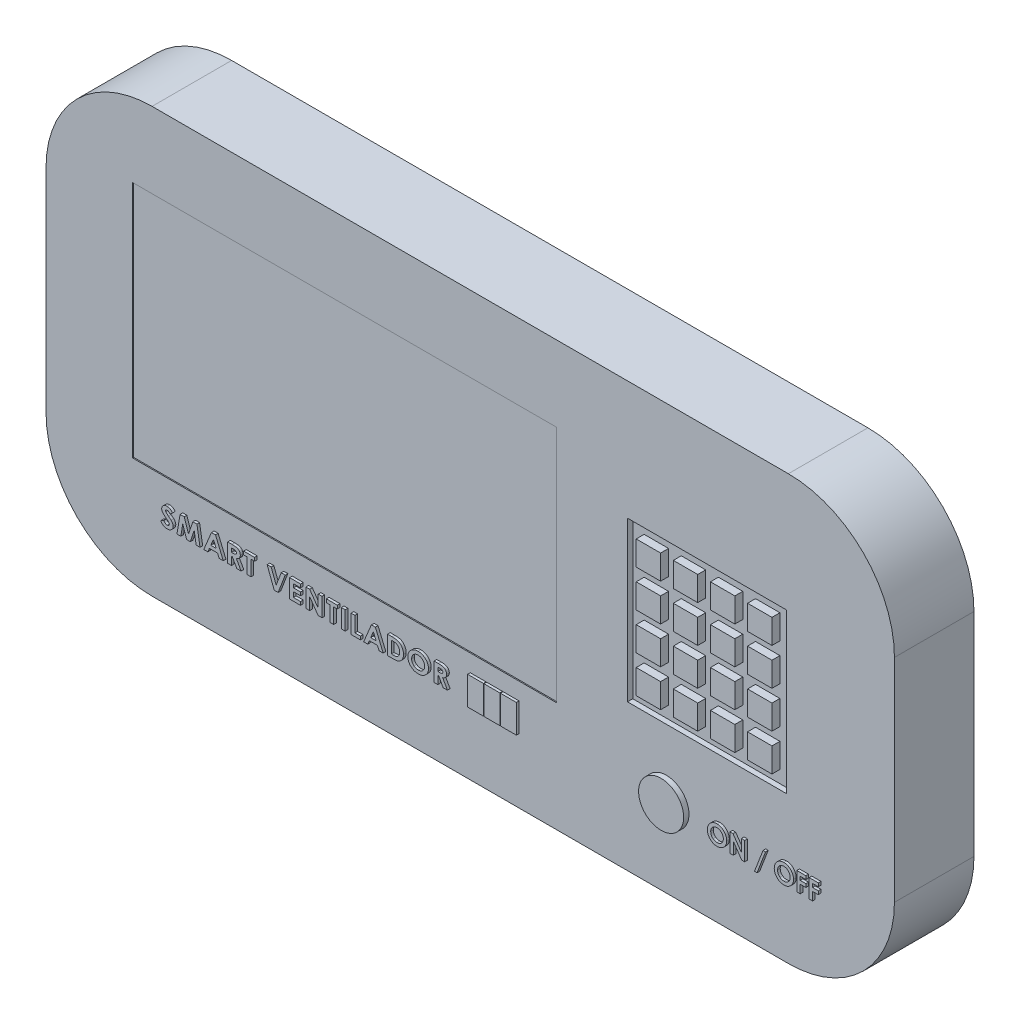
from build123d import *

# Parameters (mm, degrees)
SALIENTE_EXTRUIR1_DEPTH = 15
CROQUIS2_W              = 0.717948718
CROQUIS2_H              = 3.5
SALIENTE_EXTRUIR2_DEPTH = 0.5
SALIENTE_EXTRUIR3_DEPTH = 0.5
CROQUIS4_W              = 3
CROQUIS4_H              = 5.35
SALIENTE_EXTRUIR4_DEPTH = 0.5
CROQUIS5_W              = 80
CROQUIS5_H              = 45
CORTAR_EXTRUIR1_DEPTH   = 0.2
CROQUIS6_R              = 4.25
SALIENTE_EXTRUIR5_DEPTH = 1
CROQUIS7_W              = 30
CROQUIS7_H              = 30
CORTAR_EXTRUIR2_DEPTH   = 1
CROQUIS8_W              = 4.6
CROQUIS8_H              = 4.6
SALIENTE_EXTRUIR6_DEPTH = 1.5


with BuildPart() as part:
    # Croquis1 → Saliente-Extruir1 (new body)
    with BuildSketch(Plane.XY):
        with BuildLine():
            Line((-60, 40), (60, 40))
            ThreePointArc((60, 40), (74.142135624, 34.142135624), (80, 20))
            Line((80, 20), (80, -20))
            ThreePointArc((80, -20), (74.142135624, -34.142135624), (60, -40))
            Line((60, -40), (-60, -40))
            ThreePointArc((-60, -40), (-74.142135624, -34.142135624), (-80, -20))
            Line((-80, -20), (-80, 20))
            ThreePointArc((-80, 20), (-74.142135624, 34.142135624), (-60, 40))
        make_face()
    extrude(amount=SALIENTE_EXTRUIR1_DEPTH)

    # Croquis2 → Saliente-Extruir2 (add)
    # profile 1 of 15: a face of its own
    with BuildSketch(Plane.XY.offset(15)):
        with BuildLine():
            Line((-55.621794872, -23.967648237), (-56.124499199, -24.397435897))
            add(Edge.make_bspline(
                [(-56.124499199, -24.397435897), (-56.146289856, -24.369052903), (-56.188135035, -24.314548283), (-56.25497565, -24.241417992), (-56.321613686, -24.178938925), (-56.389157899, -24.127891339), (-56.457402581, -24.088145818), (-56.525956881, -24.059708882), (-56.594969249, -24.041735408), (-56.641356448, -24.039546945), (-56.664362981, -24.038461538)],
                knots=[0, 0, 0, 0, 1.277318712, 2.45286911, 3.533588782, 4.535065184, 5.46981375, 6.345469513, 7.179407024, 8, 8, 8, 8], degree=3))
            add(Edge.make_bspline(
                [(-56.664362981, -24.038461538), (-56.685708, -24.039134703), (-56.726753785, -24.040429176), (-56.785411939, -24.054125009), (-56.837942834, -24.076617586), (-56.883402375, -24.107395247), (-56.919967376, -24.143408068), (-56.948410812, -24.181892879), (-56.964226243, -24.224287201), (-56.966717538, -24.253360534), (-56.967948718, -24.267728365)],
                knots=[0, 0, 0, 0, 1.217479296, 2.341173553, 3.417477448, 4.465338837, 5.456563799, 6.338062097, 7.178682312, 8, 8, 8, 8], degree=3))
            add(Edge.make_bspline(
                [(-56.967948718, -24.267728365), (-56.967009562, -24.282279816), (-56.965119584, -24.311563489), (-56.953687441, -24.354965153), (-56.933634537, -24.39668002), (-56.915522489, -24.422220823), (-56.90625, -24.435296474)],
                knots=[0, 0, 0, 0, 0.961387754, 1.934718672, 2.942676219, 4, 4, 4, 4], degree=3))
            add(Edge.make_bspline(
                [(-56.90625, -24.435296474), (-56.897475032, -24.445443587), (-56.8773462, -24.468719972), (-56.839966216, -24.505985803), (-56.792711248, -24.551312586), (-56.73411001, -24.603713536), (-56.665633125, -24.664052852), (-56.585804218, -24.73140971), (-56.495945341, -24.806807025), (-56.432106155, -24.859299305), (-56.398637821, -24.88681891)],
                knots=[0, 0, 0, 0, 0.473340372, 1.085791838, 1.861725834, 2.784458208, 3.859937724, 5.082978446, 6.470722139, 8, 8, 8, 8], degree=3))
            add(Edge.make_bspline(
                [(-56.398637821, -24.88681891), (-56.367365202, -24.912346913), (-56.307902408, -24.960886702), (-56.222817611, -25.02895694), (-56.14876769, -25.091314709), (-56.083233629, -25.144587126), (-56.028757454, -25.192132522), (-55.982907862, -25.231042236), (-55.94721146, -25.263154834), (-55.926982844, -25.282449354), (-55.918369391, -25.290665064)],
                knots=[0, 0, 0, 0, 1.543675599, 2.93519593, 4.166390145, 5.245405028, 6.164324761, 6.931062555, 7.544840672, 8, 8, 8, 8], degree=3))
            add(Edge.make_bspline(
                [(-55.918369391, -25.290665064), (-55.885307432, -25.324027525), (-55.82196052, -25.387950201), (-55.7400681, -25.488103721), (-55.671208768, -25.584606887), (-55.619286054, -25.681766822), (-55.580173713, -25.779444659), (-55.551371343, -25.880075893), (-55.535469285, -25.985433689), (-55.533199129, -26.057175217), (-55.532051282, -26.093449519)],
                knots=[0, 0, 0, 0, 1.227179859, 2.351284024, 3.378339862, 4.321367522, 5.223305034, 6.124621562, 7.051761985, 8, 8, 8, 8], degree=3))
            add(Edge.make_bspline(
                [(-55.532051282, -26.093449519), (-55.532948725, -26.128793717), (-55.534710133, -26.198163628), (-55.549946823, -26.299891443), (-55.57419614, -26.396801614), (-55.608795548, -26.489155011), (-55.65435804, -26.576108706), (-55.707965454, -26.65967524), (-55.773666543, -26.736640245), (-55.846628631, -26.809722689), (-55.928573554, -26.874969173), (-56.016483024, -26.933116888), (-56.110877326, -26.981444891), (-56.211416346, -27.021013696), (-56.317860466, -27.051443209), (-56.430102551, -27.074099574), (-56.548345125, -27.087607188), (-56.629271305, -27.089020527), (-56.670673077, -27.08974359)],
                knots=[0, 0, 0, 0, 0.999766624, 1.962237841, 2.90384921, 3.82270094, 4.745614044, 5.677512525, 6.625951363, 7.603395152, 8.596026376, 9.584772012, 10.581624785, 11.591187941, 12.637768575, 13.710459695, 14.828672936, 16, 16, 16, 16], degree=3))
            add(Edge.make_bspline(
                [(-56.670673077, -27.08974359), (-56.703176817, -27.089217749), (-56.767360292, -27.088179398), (-56.861969011, -27.079567785), (-56.953329077, -27.065688977), (-57.041404863, -27.045967813), (-57.126450099, -27.02069371), (-57.208533337, -26.989940404), (-57.287284149, -26.953377679), (-57.362850669, -26.911094006), (-57.435238015, -26.8624943), (-57.504855089, -26.807646704), (-57.571531972, -26.746159084), (-57.636403669, -26.678885064), (-57.697615102, -26.604360338), (-57.757027279, -26.524139134), (-57.812975486, -26.436968651), (-57.847680101, -26.375704797), (-57.865384615, -26.344451122)],
                knots=[0, 0, 0, 0, 1.047498313, 2.068441419, 3.059231922, 4.024170881, 4.975130488, 5.916735576, 6.846911781, 7.770998236, 8.70488822, 9.654295141, 10.62465836, 11.626271271, 12.664055072, 13.730743618, 14.842341825, 16, 16, 16, 16], degree=3))
            Line((-57.865384615, -26.344451122), (-57.280649038, -26.012820513))
            add(Edge.make_bspline(
                [(-57.280649038, -26.012820513), (-57.258849225, -26.048304191), (-57.216972833, -26.116466628), (-57.146506653, -26.207835884), (-57.074332303, -26.285754338), (-56.999642452, -26.349882612), (-56.92189244, -26.399871584), (-56.841235638, -26.435248222), (-56.758099105, -26.457514661), (-56.701655962, -26.460198563), (-56.673477564, -26.461538462)],
                knots=[0, 0, 0, 0, 1.263139482, 2.426430153, 3.495266246, 4.48153534, 5.406311373, 6.289232501, 7.145924809, 8, 8, 8, 8], degree=3))
            add(Edge.make_bspline(
                [(-56.673477564, -26.461538462), (-56.644611798, -26.460427934), (-56.588553277, -26.458271242), (-56.50847831, -26.438670575), (-56.435087107, -26.407823413), (-56.371715304, -26.363592617), (-56.318347924, -26.312523326), (-56.278505191, -26.255952761), (-56.254501415, -26.194111778), (-56.25150506, -26.151374612), (-56.25, -26.129907853)],
                knots=[0, 0, 0, 0, 1.163832301, 2.260210803, 3.308505476, 4.360742954, 5.361758128, 6.277907902, 7.134997948, 8, 8, 8, 8], degree=3))
            add(Edge.make_bspline(
                [(-56.25, -26.129907853), (-56.251053154, -26.109913324), (-56.25319924, -26.069169086), (-56.272198552, -26.008810139), (-56.301357619, -25.948683936), (-56.334962444, -25.899221318), (-56.36915887, -25.857510997), (-56.403101085, -25.82237622), (-56.44285038, -25.782162626), (-56.490221528, -25.738823552), (-56.544215052, -25.691417385), (-56.60440172, -25.639060929), (-56.672627629, -25.58424669), (-56.720215817, -25.546101686), (-56.744991987, -25.526241987)],
                knots=[0, 0, 0, 0, 0.892402583, 1.818510659, 2.804945013, 3.874697065, 4.483648646, 5.215708092, 6.058298861, 7.012472764, 8.086251532, 9.272156419, 10.579783825, 12, 12, 12, 12], degree=3))
            add(Edge.make_bspline(
                [(-56.744991987, -25.526241987), (-56.792595144, -25.488580671), (-56.883801312, -25.416422761), (-57.012482935, -25.309445746), (-57.1282728, -25.209257028), (-57.231319178, -25.115932348), (-57.320538304, -25.028596536), (-57.397498672, -24.949037383), (-57.460855337, -24.875621628), (-57.526514531, -24.788161755), (-57.589860792, -24.682245905), (-57.644464019, -24.554229067), (-57.679918898, -24.426214145), (-57.683927776, -24.340158058), (-57.685897436, -24.297876603)],
                knots=[0, 0, 0, 0, 1.365689936, 2.616619431, 3.764752617, 4.810693309, 5.744036183, 6.573410299, 7.300607496, 7.924251543, 9.032571599, 10.066881874, 11.050211877, 12, 12, 12, 12], degree=3))
            add(Edge.make_bspline(
                [(-57.685897436, -24.297876603), (-57.685252341, -24.267897142), (-57.683979896, -24.208762954), (-57.668940926, -24.12192614), (-57.646929887, -24.038089329), (-57.615077998, -23.957638929), (-57.573918159, -23.880672583), (-57.52397253, -23.806805574), (-57.464605843, -23.73648345), (-57.396962419, -23.670306604), (-57.322540274, -23.610146588), (-57.243769314, -23.555987631), (-57.159796657, -23.511319482), (-57.072140727, -23.473970396), (-56.980127657, -23.444934379), (-56.883837145, -23.424808468), (-56.783159403, -23.412750318), (-56.714643344, -23.411097325), (-56.67978766, -23.41025641)],
                knots=[0, 0, 0, 0, 0.963119029, 1.899742706, 2.825934193, 3.747110609, 4.675130108, 5.627810591, 6.609404785, 7.629881686, 8.666397204, 9.683713782, 10.699279647, 11.719756548, 12.744294213, 13.79681864, 14.879191321, 16, 16, 16, 16], degree=3))
            add(Edge.make_bspline(
                [(-56.67978766, -23.41025641), (-56.634587808, -23.411762324), (-56.544798192, -23.414753825), (-56.412132871, -23.438090378), (-56.282727228, -23.4753693), (-56.177833707, -23.519282189), (-56.094673672, -23.563292532), (-56.030307968, -23.602325975), (-55.965302292, -23.648471373), (-55.898169078, -23.699329681), (-55.831367999, -23.758336927), (-55.761687897, -23.821642087), (-55.691581219, -23.892124724), (-55.645472562, -23.942023994), (-55.621794872, -23.967648237)],
                knots=[0, 0, 0, 0, 1.316312799, 2.614858576, 3.91215405, 5.233669687, 5.919003686, 6.652379443, 7.424978738, 8.240779349, 9.104907034, 10.020538666, 10.983508212, 12, 12, 12, 12], degree=3))
        make_face()
    # profile 2 of 15: a face of its own
    with BuildSketch(Plane.XY.offset(15)):
        Polygon((-54.222075321, -23.5), (-53.447335737, -23.5), (-52.633333333, -25.94130609), (-51.815825321, -23.5), (-51.044591346, -23.5), (-50.457051282, -27), (-51.185516827, -27), (-51.556410256, -24.789362981), (-52.296794872, -27), (-52.973377404, -27), (-53.71025641, -24.789362981), (-54.08114984, -27), (-54.809615385, -27), align=None)
    # profile 3 of 15: a face of its own
    with BuildSketch(Plane.XY.offset(15)):
        Polygon((-48.295913462, -23.5), (-47.538000801, -23.5), (-46.077564103, -27), (-46.848096955, -27), (-47.144671474, -26.282051282), (-48.689242788, -26.282051282), (-48.986518429, -27), (-49.757051282, -27), align=None)
        Polygon((-47.917307692, -24.438802083), (-48.428425481, -25.653846154), (-47.405488782, -25.653846154), align=None, mode=Mode.SUBTRACT)
    # profile 4 of 15: a face of its own
    with BuildSketch(Plane.XY.offset(15)):
        with BuildLine():
            Line((-45.242948718, -23.5), (-44.434555288, -23.5))
            add(Edge.make_bspline(
                [(-44.434555288, -23.5), (-44.381265107, -23.500175455), (-44.278632901, -23.500513366), (-44.130665267, -23.50568712), (-43.99433399, -23.513039221), (-43.870110327, -23.52389994), (-43.757874139, -23.538732198), (-43.657705195, -23.55600658), (-43.568980481, -23.575772154), (-43.491022503, -23.600042918), (-43.420856154, -23.628026155), (-43.355416826, -23.659550691), (-43.29346326, -23.69563823), (-43.234550609, -23.735258013), (-43.179597542, -23.77978462), (-43.128302073, -23.828546519), (-43.079767227, -23.880839033), (-43.035705744, -23.937791703), (-42.99602803, -23.997861877), (-42.960271026, -24.060511138), (-42.931347988, -24.126567713), (-42.906347379, -24.194786083), (-42.887490806, -24.265906832), (-42.874251013, -24.339534118), (-42.866447877, -24.415964307), (-42.865319344, -24.46776372), (-42.86474359, -24.494190705)],
                knots=[0, 0, 0, 0, 1.810401764, 3.486674673, 5.029519145, 6.448546818, 7.721978868, 8.874627388, 9.901230509, 10.807823259, 11.645301282, 12.465628286, 13.273214053, 14.079237002, 14.87534365, 15.672913984, 16.482098508, 17.29687332, 18.116085201, 18.926632022, 19.744110526, 20.562899031, 21.393004911, 22.24024988, 23.102212043, 24, 24, 24, 24], degree=3))
            add(Edge.make_bspline(
                [(-42.86474359, -24.494190705), (-42.865277465, -24.521787566), (-42.866325172, -24.57594527), (-42.874702614, -24.655488775), (-42.889511733, -24.731427067), (-42.909971812, -24.80409851), (-42.935655738, -24.873449017), (-42.967609643, -24.939395684), (-43.005274263, -25.001710069), (-43.049425298, -25.060217987), (-43.098206122, -25.115795368), (-43.153745284, -25.167215024), (-43.21442884, -25.215665542), (-43.281762551, -25.259625991), (-43.354067033, -25.301386036), (-43.432750456, -25.338886201), (-43.516967545, -25.37349185), (-43.575784557, -25.392920204), (-43.605829327, -25.402844551)],
                knots=[0, 0, 0, 0, 1.043198031, 2.047233251, 3.01934853, 3.964797548, 4.898614941, 5.811463997, 6.731256592, 7.646625036, 8.579229433, 9.523149634, 10.504257845, 11.511437172, 12.560232801, 13.658834121, 14.804091076, 16, 16, 16, 16], degree=3))
            Line((-43.605829327, -25.402844551), (-42.707692308, -27))
            Line((-42.707692308, -27), (-43.516786859, -27))
            Line((-43.516786859, -27), (-44.374959936, -25.474358974))
            Line((-44.374959936, -25.474358974), (-44.525, -25.474358974))
            Line((-44.525, -25.474358974), (-44.525, -27))
            Line((-44.525, -27), (-45.242948718, -27))
            Line((-45.242948718, -27), (-45.242948718, -23.5))
        make_face()
        with BuildLine():
            Line((-44.525, -24.846153846), (-44.268389423, -24.846153846))
            add(Edge.make_bspline(
                [(-44.268389423, -24.846153846), (-44.237071472, -24.845817383), (-44.176985908, -24.845171855), (-44.090408914, -24.842157457), (-44.011610482, -24.835005721), (-43.940308176, -24.825797843), (-43.876558454, -24.815495782), (-43.820773726, -24.800237994), (-43.772105192, -24.784052005), (-43.730652697, -24.764222204), (-43.69541783, -24.741216654), (-43.664877222, -24.715344442), (-43.639505477, -24.685290038), (-43.617896401, -24.652405244), (-43.60296089, -24.614982636), (-43.590747108, -24.575232984), (-43.583613224, -24.531601574), (-43.583007509, -24.501461499), (-43.582692308, -24.485777244)],
                knots=[0, 0, 0, 0, 1.708363675, 3.277608857, 4.723712974, 6.021838054, 7.199660436, 8.241690857, 9.172961181, 9.993967569, 10.739999558, 11.46313589, 12.168296226, 12.87908003, 13.598837728, 14.357076655, 15.145057537, 16, 16, 16, 16], degree=3))
            add(Edge.make_bspline(
                [(-43.582692308, -24.485777244), (-43.583336018, -24.467209088), (-43.584602537, -24.43067567), (-43.599535983, -24.378341143), (-43.62204024, -24.329279661), (-43.654852889, -24.285602051), (-43.694278284, -24.245850119), (-43.740851398, -24.212329472), (-43.793446601, -24.184692941), (-43.842302226, -24.167102448), (-43.886985236, -24.156141878), (-43.927224607, -24.148536479), (-43.974072094, -24.142480076), (-44.026881891, -24.136801518), (-44.086283572, -24.132702433), (-44.151978891, -24.129955443), (-44.224214644, -24.128766607), (-44.274465631, -24.12839743), (-44.300641026, -24.128205128)],
                knots=[0, 0, 0, 0, 0.985252127, 1.938513972, 2.873098658, 3.843165384, 4.828025027, 5.842890392, 6.883115312, 7.980634618, 8.595920604, 9.330050158, 10.158404267, 11.108741491, 12.156004298, 13.326020887, 14.60714262, 16, 16, 16, 16], degree=3))
            Line((-44.300641026, -24.128205128), (-44.525, -24.128205128))
            Line((-44.525, -24.128205128), (-44.525, -24.846153846))
        make_face(mode=Mode.SUBTRACT)
    # profile 5 of 15: a face of its own
    with BuildSketch(Plane.XY.offset(15)):
        Polygon((-42.232051282, -23.5), (-40.167948718, -23.5), (-40.167948718, -24.128205128), (-40.841025641, -24.128205128), (-40.841025641, -27), (-41.558974359, -27), (-41.558974359, -24.128205128), (-42.232051282, -24.128205128), align=None)
    # profile 6 of 15: a face of its own
    with BuildSketch(Plane.XY.offset(15)):
        Polygon((-37.803205128, -23.5), (-37.045292468, -23.5), (-36.098076923, -25.986177885), (-35.150160256, -23.5), (-34.392948718, -23.5), (-35.728585737, -27), (-36.469671474, -27), align=None)
    # profile 7 of 15: a face of its own
    with BuildSketch(Plane.XY.offset(15)):
        Polygon((-33.558333333, -23.5), (-31.494230769, -23.5), (-31.494230769, -24.128205128), (-32.840384615, -24.128205128), (-32.840384615, -24.801282051), (-31.494230769, -24.801282051), (-31.494230769, -25.429487179), (-32.840384615, -25.429487179), (-32.840384615, -26.371794872), (-31.494230769, -26.371794872), (-31.494230769, -27), (-33.558333333, -27), align=None)
    # profile 8 of 15: a face of its own
    with BuildSketch(Plane.XY.offset(15)):
        Polygon((-30.502564103, -23.5), (-29.784615385, -23.5), (-28.169230769, -25.803185096), (-28.169230769, -23.5), (-27.451282051, -23.5), (-27.451282051, -27), (-28.174138622, -27), (-29.784615385, -24.703826122), (-29.784615385, -27), (-30.502564103, -27), align=None)
    # profile 9 of 15: a face of its own
    with BuildSketch(Plane.XY.offset(15)):
        Polygon((-26.639102564, -23.5), (-24.575, -23.5), (-24.575, -24.128205128), (-25.248076923, -24.128205128), (-25.248076923, -27), (-25.966025641, -27), (-25.966025641, -24.128205128), (-26.639102564, -24.128205128), align=None)
    # profile 10 of 15: a face of its own
    with BuildSketch(Plane.XY.offset(15)):
        with Locations((-23.448717949, -25.25)):
            Rectangle(CROQUIS2_W, CROQUIS2_H)
    # profile 11 of 15: a face of its own
    with BuildSketch(Plane.XY.offset(15)):
        Polygon((-21.963461538, -23.5), (-21.245512821, -23.5), (-21.245512821, -26.371794872), (-20.213461538, -26.371794872), (-20.213461538, -27), (-21.963461538, -27), align=None)
    # profile 12 of 15: a face of its own
    with BuildSketch(Plane.XY.offset(15)):
        Polygon((-18.142067308, -23.5), (-17.384154647, -23.5), (-15.923717949, -27), (-16.694250801, -27), (-16.990825321, -26.282051282), (-18.535396635, -26.282051282), (-18.832672276, -27), (-19.603205128, -27), align=None)
        Polygon((-17.763461538, -24.438802083), (-18.274579327, -25.653846154), (-17.251642628, -25.653846154), align=None, mode=Mode.SUBTRACT)
    # profile 13 of 15: a face of its own
    with BuildSketch(Plane.XY.offset(15)):
        with BuildLine():
            Line((-15.089102564, -23.5), (-14.233733974, -23.5))
            add(Edge.make_bspline(
                [(-14.233733974, -23.5), (-14.167115878, -23.500440041), (-14.038019366, -23.50129278), (-13.851172702, -23.510604157), (-13.677398484, -23.525141864), (-13.517020687, -23.544900338), (-13.369748206, -23.571440439), (-13.235954914, -23.603997662), (-13.11523895, -23.642541745), (-13.006167626, -23.686839375), (-12.906658687, -23.739404228), (-12.812176127, -23.797553853), (-12.722509227, -23.863602285), (-12.637169505, -23.93693004), (-12.556419678, -24.01787888), (-12.480017709, -24.1061978), (-12.408543125, -24.202072298), (-12.341190839, -24.304013839), (-12.280380071, -24.412095913), (-12.227696191, -24.525643104), (-12.182676845, -24.643413628), (-12.1463217, -24.766076498), (-12.117455275, -24.892974439), (-12.097277451, -25.024410198), (-12.085193718, -25.160262092), (-12.083535015, -25.252312227), (-12.082692308, -25.299078526)],
                knots=[0, 0, 0, 0, 1.494078584, 2.895314429, 4.194726073, 5.404700159, 6.518210919, 7.549273854, 8.490856347, 9.358190944, 10.185824783, 11.01206306, 11.844513431, 12.680866051, 13.533374415, 14.406691734, 15.29780874, 16.213741172, 17.145466963, 18.07648471, 19.018854785, 19.970798204, 20.943612606, 21.93555847, 22.95115539, 24, 24, 24, 24], degree=3))
            add(Edge.make_bspline(
                [(-12.082692308, -25.299078526), (-12.084385202, -25.365081884), (-12.087719972, -25.495099473), (-12.115837034, -25.685863659), (-12.161238187, -25.868758476), (-12.225295063, -26.04208324), (-12.303767102, -26.204966693), (-12.398321804, -26.353557636), (-12.506210158, -26.488135732), (-12.627351514, -26.60667599), (-12.757680651, -26.709560333), (-12.894126352, -26.796648146), (-13.036654089, -26.865975127), (-13.162033234, -26.909363105), (-13.270866491, -26.936930779), (-13.366414268, -26.95272168), (-13.475314811, -26.967747647), (-13.598166392, -26.979006885), (-13.734637039, -26.989235262), (-13.884776542, -26.994759812), (-14.048375565, -26.999369193), (-14.161981668, -26.999784061), (-14.221113782, -27)],
                knots=[0, 0, 0, 0, 1.259954248, 2.481937546, 3.673749466, 4.852781836, 6.004533842, 7.120124249, 8.208893917, 9.291425112, 10.349538388, 11.374759778, 12.37682138, 13.36910449, 13.902767555, 14.519139419, 15.217253139, 16.001986812, 16.874547636, 17.830513077, 18.870779437, 20, 20, 20, 20], degree=3))
            Line((-14.221113782, -27), (-15.089102564, -27))
            Line((-15.089102564, -27), (-15.089102564, -23.5))
        make_face()
        with BuildLine():
            Line((-14.371153846, -24.128205128), (-14.371153846, -26.371794872))
            Line((-14.371153846, -26.371794872), (-14.033914263, -26.371794872))
            add(Edge.make_bspline(
                [(-14.033914263, -26.371794872), (-13.993704364, -26.371720764), (-13.916279183, -26.371578068), (-13.804591698, -26.365050097), (-13.701305501, -26.358446668), (-13.606687144, -26.345933026), (-13.520049075, -26.332138277), (-13.442607731, -26.312648738), (-13.37293984, -26.292489306), (-13.311761484, -26.26650573), (-13.255726005, -26.237163866), (-13.20327454, -26.203482696), (-13.153099363, -26.165283512), (-13.105516099, -26.122811234), (-13.06131997, -26.075170377), (-13.018862434, -26.024048773), (-12.979718256, -25.967483223), (-12.942824585, -25.906935021), (-12.908685442, -25.842434031), (-12.880470513, -25.773629266), (-12.855601119, -25.701601924), (-12.835272514, -25.62596695), (-12.820073887, -25.546478663), (-12.808922419, -25.463389795), (-12.801628614, -25.3767997), (-12.800973365, -25.317790001), (-12.800641026, -25.287860577)],
                knots=[0, 0, 0, 0, 1.523669709, 2.933864728, 4.239623319, 5.444890021, 6.550182806, 7.56208441, 8.469926649, 9.295760893, 10.07631634, 10.865071544, 11.655218202, 12.464400176, 13.279042311, 14.116059622, 14.981059707, 15.883440539, 16.80262051, 17.743607914, 18.698829689, 19.68937621, 20.709117789, 21.763920273, 22.865871542, 24, 24, 24, 24], degree=3))
            add(Edge.make_bspline(
                [(-12.800641026, -25.287860577), (-12.801795131, -25.242014036), (-12.804045335, -25.152625322), (-12.819303878, -25.022278692), (-12.845968965, -24.89972513), (-12.883039503, -24.785002249), (-12.93055445, -24.678033878), (-12.990623732, -24.580323287), (-13.058658021, -24.48838639), (-13.113267077, -24.435304905), (-13.140685096, -24.408653846)],
                knots=[0, 0, 0, 0, 1.132793406, 2.208649617, 3.237138899, 4.226931707, 5.183258886, 6.121135875, 7.056663184, 8, 8, 8, 8], degree=3))
            add(Edge.make_bspline(
                [(-13.140685096, -24.408653846), (-13.167686105, -24.38589392), (-13.222710946, -24.339511899), (-13.318325142, -24.283376889), (-13.424073668, -24.2344774), (-13.542096734, -24.195782766), (-13.671289041, -24.164948743), (-13.812267233, -24.143866178), (-13.964465887, -24.130197716), (-14.069873194, -24.12888413), (-14.124358974, -24.128205128)],
                knots=[0, 0, 0, 0, 0.809370818, 1.64940136, 2.535194483, 3.480162931, 4.495135713, 5.58092784, 6.749564542, 8, 8, 8, 8], degree=3))
            Line((-14.124358974, -24.128205128), (-14.371153846, -24.128205128))
        make_face(mode=Mode.SUBTRACT)
    # profile 14 of 15: a face of its own
    with BuildSketch(Plane.XY.offset(15)):
        with BuildLine():
            add(Edge.make_bspline(
                [(-9.310877404, -23.41025641), (-9.245590426, -23.41183385), (-9.116622242, -23.41494993), (-8.926933465, -23.44085525), (-8.744223954, -23.482788879), (-8.568635489, -23.542172451), (-8.399822241, -23.617866054), (-8.23837791, -23.711439702), (-8.083650393, -23.820935467), (-7.938540025, -23.946717266), (-7.804564749, -24.083115991), (-7.687498586, -24.229459884), (-7.588968719, -24.383431862), (-7.506422489, -24.543723881), (-7.444132904, -24.712725905), (-7.399136318, -24.888644483), (-7.371873427, -25.072233743), (-7.368420677, -25.197089574), (-7.366666667, -25.260516827)],
                knots=[0, 0, 0, 0, 1.049696402, 2.073574885, 3.072906237, 4.060690321, 5.04995375, 6.043499802, 7.057254493, 8.094057568, 9.12807687, 10.128390374, 11.102251621, 12.063819208, 13.022458253, 13.992481724, 14.980172828, 16, 16, 16, 16], degree=3))
            add(Edge.make_bspline(
                [(-7.366666667, -25.260516827), (-7.368492357, -25.323236969), (-7.372091511, -25.446883058), (-7.398374579, -25.628619092), (-7.442560798, -25.803101475), (-7.505515169, -25.969743308), (-7.585112963, -26.129591794), (-7.683210773, -26.281474162), (-7.7991837, -26.425780526), (-7.930557875, -26.561311217), (-8.074866142, -26.684520942), (-8.228026734, -26.793316836), (-8.389433547, -26.884555986), (-8.55793463, -26.960471327), (-8.734499069, -27.01852903), (-8.918329075, -27.059837069), (-9.109660605, -27.084961584), (-9.239753736, -27.088130599), (-9.305969551, -27.08974359)],
                knots=[0, 0, 0, 0, 1.014050959, 1.999093624, 2.962474041, 3.919248956, 4.874193364, 5.844951248, 6.837131159, 7.863453727, 8.892777976, 9.901511838, 10.896710297, 11.886360502, 12.885490882, 13.896784394, 14.929488937, 16, 16, 16, 16], degree=3))
            add(Edge.make_bspline(
                [(-9.305969551, -27.08974359), (-9.375008423, -27.088291799), (-9.510554411, -27.085441458), (-9.709149767, -27.05812464), (-9.899532131, -27.017235428), (-10.080215407, -26.955959934), (-10.252629891, -26.879751533), (-10.415281427, -26.784791757), (-10.569479181, -26.673684892), (-10.712752381, -26.546646581), (-10.842831468, -26.408271166), (-10.957455281, -26.26191399), (-11.05378386, -26.108597758), (-11.132987114, -25.948899842), (-11.195210409, -25.78316189), (-11.238294393, -25.610473675), (-11.266229058, -25.431802797), (-11.269073149, -25.310168669), (-11.270512821, -25.248597756)],
                knots=[0, 0, 0, 0, 1.104586766, 2.168666752, 3.203450315, 4.217361517, 5.217176418, 6.21629109, 7.226606606, 8.255013025, 9.276660051, 10.26302175, 11.226301965, 12.16996216, 13.11228646, 14.054165042, 15.015022858, 16, 16, 16, 16], degree=3))
            add(Edge.make_bspline(
                [(-11.270512821, -25.248597756), (-11.269651696, -25.207204372), (-11.267940501, -25.124948905), (-11.255839161, -25.002866017), (-11.235650118, -24.883327473), (-11.206465321, -24.766577319), (-11.170354647, -24.652025237), (-11.124891718, -24.540329029), (-11.072595941, -24.430618131), (-11.011247185, -24.324426444), (-10.943983444, -24.221627635), (-10.868976747, -24.124556215), (-10.788455673, -24.032496831), (-10.701342532, -23.946250725), (-10.608319395, -23.865612829), (-10.510278383, -23.789119478), (-10.404536733, -23.720289994), (-10.294243443, -23.655890436), (-10.179860861, -23.597476314), (-10.061799015, -23.548383894), (-9.942386308, -23.504631261), (-9.820018286, -23.470987487), (-9.695922658, -23.442910277), (-9.569295599, -23.424727916), (-9.440852154, -23.41183422), (-9.354379952, -23.410784503), (-9.310877404, -23.41025641)],
                knots=[0, 0, 0, 0, 0.997678596, 1.982551546, 2.954058229, 3.917298017, 4.881130648, 5.846673895, 6.821767171, 7.808378587, 8.800523032, 9.780793558, 10.762778381, 11.746684189, 12.732909544, 13.728980508, 14.741436122, 15.771402875, 16.806854874, 17.834307421, 18.851765781, 19.870097094, 20.891120496, 21.916470583, 22.951815307, 24, 24, 24, 24], degree=3))
        make_face()
        with BuildLine():
            add(Edge.make_bspline(
                [(-9.321394231, -24.038461538), (-9.363982299, -24.0395518), (-9.447832752, -24.041698384), (-9.570804888, -24.05826183), (-9.688813221, -24.084622187), (-9.801426864, -24.122875871), (-9.909094202, -24.171249157), (-10.011566728, -24.230626805), (-10.108464839, -24.30101369), (-10.199109063, -24.381505835), (-10.282207388, -24.469442718), (-10.354274515, -24.565102058), (-10.415430558, -24.666103175), (-10.465536208, -24.773069339), (-10.505375122, -24.885641786), (-10.531864996, -25.004577872), (-10.549615725, -25.128874415), (-10.55156778, -25.213710923), (-10.552564103, -25.257011218)],
                knots=[0, 0, 0, 0, 1.055204393, 2.077562293, 3.069591117, 4.047707093, 5.019870956, 5.990497881, 6.977627683, 7.982959847, 8.991041444, 9.971093488, 10.945584032, 11.912071583, 12.893953377, 13.898567786, 14.927435399, 16, 16, 16, 16], degree=3))
            add(Edge.make_bspline(
                [(-10.552564103, -25.257011218), (-10.551271287, -25.305001276), (-10.54873573, -25.399122627), (-10.527275676, -25.536241973), (-10.492394087, -25.665769954), (-10.442569743, -25.787154188), (-10.380464559, -25.901861636), (-10.302036962, -26.007159969), (-10.211414419, -26.106254736), (-10.141094794, -26.163252366), (-10.105248397, -26.192307692)],
                knots=[0, 0, 0, 0, 1.069242721, 2.097071222, 3.085376775, 4.052797002, 5.015732193, 5.984778196, 6.972712951, 8, 8, 8, 8], degree=3))
            add(Edge.make_bspline(
                [(-10.105248397, -26.192307692), (-10.076162771, -26.213875259), (-10.018438342, -26.256679062), (-9.926126916, -26.311019686), (-9.831099917, -26.357809655), (-9.732721781, -26.395589889), (-9.631205614, -26.425300124), (-9.526344166, -26.446189761), (-9.418242888, -26.459175474), (-9.345035114, -26.460745676), (-9.308072917, -26.461538462)],
                knots=[0, 0, 0, 0, 1.013047639, 2.010532423, 2.993667268, 3.975386105, 4.956756072, 5.951146405, 6.965545226, 8, 8, 8, 8], degree=3))
            add(Edge.make_bspline(
                [(-9.308072917, -26.461538462), (-9.266421699, -26.460436256), (-9.184437628, -26.458266731), (-9.063705389, -26.441815916), (-8.94795747, -26.414553165), (-8.836767764, -26.376457491), (-8.730394784, -26.327018136), (-8.628632482, -26.266721732), (-8.532065884, -26.195051157), (-8.440856921, -26.114322515), (-8.357015658, -26.02568753), (-8.284935011, -25.929604525), (-8.22231683, -25.829629756), (-8.171603475, -25.724101644), (-8.133040522, -25.612936768), (-8.105074892, -25.497208805), (-8.087665977, -25.376260807), (-8.085644701, -25.293995963), (-8.084615385, -25.252103365)],
                knots=[0, 0, 0, 0, 1.042754808, 2.05250381, 3.044734659, 4.016369353, 4.99039802, 5.977003884, 6.973093156, 7.997105831, 9.023907439, 10.022314898, 10.999976081, 11.973705823, 12.947259684, 13.940853027, 14.951398795, 16, 16, 16, 16], degree=3))
            add(Edge.make_bspline(
                [(-8.084615385, -25.252103365), (-8.085656387, -25.210445433), (-8.087706236, -25.128416316), (-8.105019093, -25.007920385), (-8.133026213, -24.892349767), (-8.172261461, -24.781423231), (-8.224112525, -24.676108523), (-8.285881555, -24.574874586), (-8.360198267, -24.479647326), (-8.443806286, -24.389645375), (-8.535429044, -24.30750621), (-8.63350235, -24.235679973), (-8.735791424, -24.174227385), (-8.843610065, -24.124808149), (-8.956160167, -24.086300336), (-9.073435636, -24.057984123), (-9.195904745, -24.041756791), (-9.279045927, -24.039573571), (-9.321394231, -24.038461538)],
                knots=[0, 0, 0, 0, 1.03575694, 2.039520994, 3.020797989, 3.989755797, 4.959480517, 5.935526576, 6.934295908, 7.95845522, 8.987666614, 9.98988092, 10.977832937, 11.950601889, 12.934097473, 13.932325338, 14.946821381, 16, 16, 16, 16], degree=3))
        make_face(mode=Mode.SUBTRACT)
    # profile 15 of 15: a face of its own
    with BuildSketch(Plane.XY.offset(15)):
        with BuildLine():
            Line((-6.330128205, -23.5), (-5.521734776, -23.5))
            add(Edge.make_bspline(
                [(-5.521734776, -23.5), (-5.468444594, -23.500175455), (-5.365812388, -23.500513366), (-5.217844754, -23.50568712), (-5.081513477, -23.513039221), (-4.957289814, -23.52389994), (-4.845053626, -23.538732198), (-4.744884682, -23.55600658), (-4.656159968, -23.575772154), (-4.578201991, -23.600042918), (-4.508035641, -23.628026155), (-4.442596314, -23.659550691), (-4.380642747, -23.69563823), (-4.321730096, -23.735258013), (-4.26677703, -23.77978462), (-4.21548156, -23.828546519), (-4.166946715, -23.880839033), (-4.122885231, -23.937791703), (-4.083207517, -23.997861877), (-4.047450513, -24.060511138), (-4.018527476, -24.126567713), (-3.993526867, -24.194786083), (-3.974670293, -24.265906832), (-3.9614305, -24.339534118), (-3.953627365, -24.415964307), (-3.952498831, -24.46776372), (-3.951923077, -24.494190705)],
                knots=[0, 0, 0, 0, 1.810401764, 3.486674673, 5.029519145, 6.448546818, 7.721978868, 8.874627388, 9.901230509, 10.807823259, 11.645301282, 12.465628286, 13.273214053, 14.079237002, 14.87534365, 15.672913984, 16.482098508, 17.29687332, 18.116085201, 18.926632022, 19.744110526, 20.562899031, 21.393004911, 22.24024988, 23.102212043, 24, 24, 24, 24], degree=3))
            add(Edge.make_bspline(
                [(-3.951923077, -24.494190705), (-3.952456952, -24.521787566), (-3.95350466, -24.57594527), (-3.961882102, -24.655488775), (-3.97669122, -24.731427067), (-3.997151299, -24.80409851), (-4.022835225, -24.873449017), (-4.05478913, -24.939395684), (-4.09245375, -25.001710069), (-4.136604785, -25.060217987), (-4.185385609, -25.115795368), (-4.240924771, -25.167215024), (-4.301608327, -25.215665542), (-4.368942038, -25.259625991), (-4.44124652, -25.301386036), (-4.519929943, -25.338886201), (-4.604147032, -25.37349185), (-4.662964044, -25.392920204), (-4.693008814, -25.402844551)],
                knots=[0, 0, 0, 0, 1.043198031, 2.047233251, 3.01934853, 3.964797548, 4.898614941, 5.811463997, 6.731256592, 7.646625036, 8.579229433, 9.523149634, 10.504257845, 11.511437172, 12.560232801, 13.658834121, 14.804091076, 16, 16, 16, 16], degree=3))
            Line((-4.693008814, -25.402844551), (-3.794871795, -27))
            Line((-3.794871795, -27), (-4.603966346, -27))
            Line((-4.603966346, -27), (-5.462139423, -25.474358974))
            Line((-5.462139423, -25.474358974), (-5.612179487, -25.474358974))
            Line((-5.612179487, -25.474358974), (-5.612179487, -27))
            Line((-5.612179487, -27), (-6.330128205, -27))
            Line((-6.330128205, -27), (-6.330128205, -23.5))
        make_face()
        with BuildLine():
            Line((-5.612179487, -24.846153846), (-5.35556891, -24.846153846))
            add(Edge.make_bspline(
                [(-5.35556891, -24.846153846), (-5.324250959, -24.845817383), (-5.264165395, -24.845171855), (-5.177588401, -24.842157457), (-5.098789969, -24.835005721), (-5.027487663, -24.825797843), (-4.963737941, -24.815495782), (-4.907953214, -24.800237994), (-4.859284679, -24.784052005), (-4.817832184, -24.764222204), (-4.782597317, -24.741216654), (-4.752056709, -24.715344442), (-4.726684964, -24.685290038), (-4.705075888, -24.652405244), (-4.690140377, -24.614982636), (-4.677926595, -24.575232984), (-4.670792711, -24.531601574), (-4.670186996, -24.501461499), (-4.669871795, -24.485777244)],
                knots=[0, 0, 0, 0, 1.708363675, 3.277608857, 4.723712974, 6.021838054, 7.199660436, 8.241690857, 9.172961181, 9.993967569, 10.739999558, 11.46313589, 12.168296226, 12.87908003, 13.598837728, 14.357076655, 15.145057537, 16, 16, 16, 16], degree=3))
            add(Edge.make_bspline(
                [(-4.669871795, -24.485777244), (-4.670515505, -24.467209088), (-4.671782024, -24.43067567), (-4.68671547, -24.378341143), (-4.709219727, -24.329279661), (-4.742032376, -24.285602051), (-4.781457771, -24.245850119), (-4.828030886, -24.212329472), (-4.880626088, -24.184692941), (-4.929481713, -24.167102448), (-4.974164723, -24.156141878), (-5.014404094, -24.148536479), (-5.061251581, -24.142480076), (-5.114061379, -24.136801518), (-5.173463059, -24.132702433), (-5.239158378, -24.129955443), (-5.311394132, -24.128766607), (-5.361645118, -24.12839743), (-5.387820513, -24.128205128)],
                knots=[0, 0, 0, 0, 0.985252127, 1.938513972, 2.873098658, 3.843165384, 4.828025027, 5.842890392, 6.883115312, 7.980634618, 8.595920604, 9.330050158, 10.158404267, 11.108741491, 12.156004298, 13.326020887, 14.60714262, 16, 16, 16, 16], degree=3))
            Line((-5.387820513, -24.128205128), (-5.612179487, -24.128205128))
            Line((-5.612179487, -24.128205128), (-5.612179487, -24.846153846))
        make_face(mode=Mode.SUBTRACT)
    extrude(amount=SALIENTE_EXTRUIR2_DEPTH)

    # Croquis3 → Saliente-Extruir3 (add)
    # profile 1 of 6: a face of its own
    with BuildSketch(Plane.XY.offset(15)):
        with BuildLine():
            add(Edge.make_bspline(
                [(47.048677885, -23.41025641), (47.109529674, -23.411831972), (47.229664889, -23.414942488), (47.406340438, -23.440871065), (47.576599997, -23.483117965), (47.740366574, -23.541844211), (47.897230118, -23.618640408), (48.047743938, -23.711329335), (48.191368901, -23.821660439), (48.326633253, -23.947059877), (48.45164191, -24.08342629), (48.559961984, -24.230248979), (48.65233337, -24.383723618), (48.728891021, -24.544261449), (48.787203923, -24.712974271), (48.828124498, -24.889001874), (48.85441394, -25.072294178), (48.85743763, -25.197091254), (48.858974359, -25.260516827)],
                knots=[0, 0, 0, 0, 1.014329547, 2.002516266, 2.970391464, 3.935626869, 4.897733899, 5.877609409, 6.878433252, 7.912639331, 8.949961323, 9.958554974, 10.949718813, 11.932905612, 12.9188844, 13.919928257, 14.942845884, 16, 16, 16, 16], degree=3))
            add(Edge.make_bspline(
                [(48.858974359, -25.260516827), (48.857337809, -25.32322774), (48.854112935, -25.446801607), (48.829197748, -25.628404801), (48.787588065, -25.802546781), (48.730264197, -25.969621722), (48.655095011, -26.128820371), (48.564524968, -26.281159188), (48.456164096, -26.425224434), (48.333964742, -26.560938796), (48.199433857, -26.684128702), (48.056944294, -26.792689593), (47.907153981, -26.884679996), (47.750282164, -26.960057773), (47.585992437, -27.01855569), (47.414690617, -27.059830222), (47.236387305, -27.084913588), (47.115132405, -27.088117397), (47.053585737, -27.08974359)],
                knots=[0, 0, 0, 0, 1.051557043, 2.072126891, 3.067553643, 4.050577992, 5.02905126, 6.015227836, 7.017913613, 8.04756643, 9.074058332, 10.072836633, 11.047628519, 12.017157415, 12.98668631, 13.966869689, 14.968021931, 16, 16, 16, 16], degree=3))
            add(Edge.make_bspline(
                [(47.053585737, -27.08974359), (46.989215302, -27.088284815), (46.862736195, -27.085418522), (46.677633456, -27.058161382), (46.500289038, -27.017102609), (46.332192737, -26.955824592), (46.171632633, -26.879221919), (46.019788412, -26.784881134), (45.8767111, -26.672958142), (45.743221415, -26.546319334), (45.622279436, -26.407748702), (45.515524417, -26.261361118), (45.425474191, -26.108274853), (45.352125462, -25.948418261), (45.29430027, -25.782784811), (45.253511168, -25.610365748), (45.229416072, -25.431574595), (45.226059765, -25.31013607), (45.224358974, -25.248597756)],
                knots=[0, 0, 0, 0, 1.067978421, 2.098431617, 3.099715153, 4.085208694, 5.062210972, 6.048429807, 7.046490867, 8.072918869, 9.098532598, 10.095778865, 11.076610158, 12.041847152, 13.011192615, 13.984257998, 14.978533688, 16, 16, 16, 16], degree=3))
            add(Edge.make_bspline(
                [(45.224358974, -25.248597756), (45.22489278, -25.207198001), (45.225953633, -25.124922706), (45.238732722, -25.002994918), (45.257130936, -24.883446997), (45.284341022, -24.766755582), (45.317394322, -24.65209747), (45.36021954, -24.540539925), (45.408966229, -24.430891208), (45.465922145, -24.324446407), (45.529251616, -24.222184903), (45.598349707, -24.12458908), (45.673390165, -24.032839017), (45.75413126, -23.946331768), (45.840851235, -23.865635952), (45.93240938, -23.789609207), (46.030581389, -23.720271075), (46.133218585, -23.65592818), (46.239742323, -23.597744015), (46.349718955, -23.548219395), (46.460882744, -23.504970387), (46.57471869, -23.470836358), (46.690006838, -23.443034548), (46.807978808, -23.424648735), (46.92756879, -23.411869999), (47.008212381, -23.41079555), (47.048677885, -23.41025641)],
                knots=[0, 0, 0, 0, 1.034744296, 2.056386356, 3.06226378, 4.057406941, 5.050368692, 6.043467995, 7.042652155, 8.049140477, 9.059438543, 10.048523776, 11.036952808, 12.020949711, 13.004946614, 13.997082645, 14.994316842, 16.007702937, 17.024872941, 18.026463647, 19.021641123, 20.005082605, 20.995858141, 21.984425357, 22.988620895, 24, 24, 24, 24], degree=3))
        make_face()
        with BuildLine():
            add(Edge.make_bspline(
                [(47.038862179, -24.038461538), (46.997908933, -24.039560406), (46.917083613, -24.041729131), (46.798527588, -24.058251881), (46.684709617, -24.08464059), (46.576260639, -24.122864313), (46.472710625, -24.171513412), (46.373876014, -24.2304179), (46.281125461, -24.301602553), (46.193222227, -24.381245785), (46.113816119, -24.469986648), (46.043658318, -24.565087575), (45.984947539, -24.666389749), (45.935776894, -24.772952096), (45.898762295, -24.885972882), (45.872397907, -25.004566803), (45.855736597, -25.128938202), (45.853636419, -25.213722022), (45.852564103, -25.257011218)],
                knots=[0, 0, 0, 0, 1.033739768, 2.040188636, 3.016340934, 3.979330865, 4.937572243, 5.900995986, 6.878200029, 7.884839167, 8.891893314, 9.879764717, 10.863503415, 11.843163062, 12.837761627, 13.859916423, 14.907309254, 16, 16, 16, 16], degree=3))
            add(Edge.make_bspline(
                [(45.852564103, -25.257011218), (45.85398583, -25.304985384), (45.85677218, -25.399006801), (45.876377277, -25.536162712), (45.909919647, -25.665692856), (45.958354177, -25.786963722), (46.018425702, -25.901321932), (46.093025001, -26.007365864), (46.18094392, -26.105730458), (46.248675943, -26.163159805), (46.283052885, -26.192307692)],
                knots=[0, 0, 0, 0, 1.078454662, 2.113592447, 3.107694534, 4.079536787, 5.043276885, 6.005368276, 6.987637804, 8, 8, 8, 8], degree=3))
            add(Edge.make_bspline(
                [(46.283052885, -26.192307692), (46.311214163, -26.213841032), (46.366902242, -26.256422561), (46.45579254, -26.310999526), (46.547332043, -26.357777429), (46.642211532, -26.395573422), (46.740230627, -26.425303114), (46.841375886, -26.446122329), (46.945503994, -26.459188186), (47.015920301, -26.460749804), (47.051482372, -26.461538462)],
                knots=[0, 0, 0, 0, 1.023928204, 2.024787132, 3.009472467, 3.9914905, 4.972207045, 5.96565515, 6.972602802, 8, 8, 8, 8], degree=3))
            add(Edge.make_bspline(
                [(47.051482372, -26.461538462), (47.091731426, -26.460430277), (47.170922706, -26.458249889), (47.287271747, -26.441930543), (47.398737661, -26.414312318), (47.50601244, -26.376423907), (47.60878675, -26.327163977), (47.706558305, -26.266432456), (47.799498526, -26.194975051), (47.887289773, -26.114285929), (47.967535122, -26.025195488), (48.037546518, -25.929587302), (48.098124007, -25.829567907), (48.146272148, -25.723721678), (48.18474911, -25.613047755), (48.210796189, -25.497055988), (48.227598249, -25.376224537), (48.229699019, -25.293994465), (48.230769231, -25.252103365)],
                knots=[0, 0, 0, 0, 1.026359118, 2.019393844, 2.989460624, 3.950973911, 4.916101784, 5.890408035, 6.881132271, 7.902007068, 8.92769091, 9.933912415, 10.920395702, 11.90457117, 12.894218921, 13.903490204, 14.931958862, 16, 16, 16, 16], degree=3))
            add(Edge.make_bspline(
                [(48.230769231, -25.252103365), (48.22966199, -25.210453151), (48.227482554, -25.128471057), (48.211134486, -25.007950264), (48.183691408, -24.892470565), (48.145689222, -24.781843373), (48.097162443, -24.675960229), (48.037154157, -24.575193483), (47.965874927, -24.479640551), (47.884965239, -24.38995259), (47.796900017, -24.307535099), (47.702353202, -24.236011698), (47.603970319, -24.173860137), (47.499493986, -24.125173114), (47.3910617, -24.086384266), (47.278011803, -24.057819601), (47.159916111, -24.041845204), (47.079573169, -24.039599481), (47.038862179, -24.038461538)],
                knots=[0, 0, 0, 0, 1.055025985, 2.07665775, 3.074803781, 4.057872707, 5.035505728, 6.020516407, 7.023567878, 8.050795229, 9.077271434, 10.074415901, 11.050397877, 12.019801805, 12.988065821, 13.964604439, 14.968634123, 16, 16, 16, 16], degree=3))
        make_face(mode=Mode.SUBTRACT)
    # profile 2 of 6: a face of its own
    with BuildSketch(Plane.XY.offset(15)):
        Polygon((49.487179487, -23.5), (50.052984776, -23.5), (51.641025641, -25.803185096), (51.641025641, -23.5), (52.269230769, -23.5), (52.269230769, -27), (51.69921875, -27), (50.115384615, -24.703826122), (50.115384615, -27), (49.487179487, -27), align=None)
    # profile 3 of 6: a face of its own
    with BuildSketch(Plane.XY.offset(15)):
        Polygon((54.108974359, -27.628205128), (55.719451122, -23.41025641), (56.195512821, -23.41025641), (54.585036058, -27.628205128), align=None)
    # profile 4 of 6: a face of its own
    with BuildSketch(Plane.XY.offset(15)):
        with BuildLine():
            add(Edge.make_bspline(
                [(59.657652244, -23.41025641), (59.718504033, -23.411831972), (59.838639248, -23.414942488), (60.015314797, -23.440871065), (60.185574356, -23.483117965), (60.349340933, -23.541844211), (60.506204477, -23.618640408), (60.656718297, -23.711329335), (60.80034326, -23.821660439), (60.935607612, -23.947059877), (61.060616269, -24.08342629), (61.168936343, -24.230248979), (61.261307729, -24.383723618), (61.33786538, -24.544261449), (61.396178282, -24.712974271), (61.437098857, -24.889001874), (61.463388299, -25.072294178), (61.466411989, -25.197091254), (61.467948718, -25.260516827)],
                knots=[0, 0, 0, 0, 1.014329547, 2.002516266, 2.970391464, 3.935626869, 4.897733899, 5.877609409, 6.878433252, 7.912639331, 8.949961323, 9.958554974, 10.949718813, 11.932905612, 12.9188844, 13.919928257, 14.942845884, 16, 16, 16, 16], degree=3))
            add(Edge.make_bspline(
                [(61.467948718, -25.260516827), (61.466312168, -25.32322774), (61.463087294, -25.446801607), (61.438172107, -25.628404801), (61.396562424, -25.802546781), (61.339238555, -25.969621722), (61.26406937, -26.128820371), (61.173499327, -26.281159188), (61.065138455, -26.425224434), (60.942939101, -26.560938796), (60.808408216, -26.684128702), (60.665918653, -26.792689593), (60.51612834, -26.884679996), (60.359256522, -26.960057773), (60.194966796, -27.01855569), (60.023664976, -27.059830222), (59.845361664, -27.084913588), (59.724106764, -27.088117397), (59.662560096, -27.08974359)],
                knots=[0, 0, 0, 0, 1.051557043, 2.072126891, 3.067553643, 4.050577992, 5.02905126, 6.015227836, 7.017913613, 8.04756643, 9.074058332, 10.072836633, 11.047628519, 12.017157415, 12.98668631, 13.966869689, 14.968021931, 16, 16, 16, 16], degree=3))
            add(Edge.make_bspline(
                [(59.662560096, -27.08974359), (59.598189661, -27.088284815), (59.471710554, -27.085418522), (59.286607815, -27.058161382), (59.109263397, -27.017102609), (58.941167096, -26.955824592), (58.780606992, -26.879221919), (58.62876277, -26.784881134), (58.485685459, -26.672958142), (58.352195774, -26.546319334), (58.231253795, -26.407748702), (58.124498776, -26.261361118), (58.03444855, -26.108274853), (57.961099821, -25.948418261), (57.903274629, -25.782784811), (57.862485527, -25.610365748), (57.838390431, -25.431574595), (57.835034124, -25.31013607), (57.833333333, -25.248597756)],
                knots=[0, 0, 0, 0, 1.067978421, 2.098431617, 3.099715153, 4.085208694, 5.062210972, 6.048429807, 7.046490867, 8.072918869, 9.098532598, 10.095778865, 11.076610158, 12.041847152, 13.011192615, 13.984257998, 14.978533688, 16, 16, 16, 16], degree=3))
            add(Edge.make_bspline(
                [(57.833333333, -25.248597756), (57.833867139, -25.207198001), (57.834927992, -25.124922706), (57.847707081, -25.002994918), (57.866105295, -24.883446997), (57.893315381, -24.766755582), (57.926368681, -24.65209747), (57.969193899, -24.540539925), (58.017940588, -24.430891208), (58.074896504, -24.324446407), (58.138225975, -24.222184903), (58.207324066, -24.12458908), (58.282364524, -24.032839017), (58.363105619, -23.946331768), (58.449825594, -23.865635952), (58.541383739, -23.789609207), (58.639555748, -23.720271075), (58.742192944, -23.65592818), (58.848716682, -23.597744015), (58.958693313, -23.548219395), (59.069857103, -23.504970387), (59.183693049, -23.470836358), (59.298981197, -23.443034548), (59.416953167, -23.424648735), (59.536543149, -23.411869999), (59.61718674, -23.41079555), (59.657652244, -23.41025641)],
                knots=[0, 0, 0, 0, 1.034744296, 2.056386356, 3.06226378, 4.057406941, 5.050368692, 6.043467995, 7.042652155, 8.049140477, 9.059438543, 10.048523776, 11.036952808, 12.020949711, 13.004946614, 13.997082645, 14.994316842, 16.007702937, 17.024872941, 18.026463647, 19.021641123, 20.005082605, 20.995858141, 21.984425357, 22.988620895, 24, 24, 24, 24], degree=3))
        make_face()
        with BuildLine():
            add(Edge.make_bspline(
                [(59.647836538, -24.038461538), (59.606883292, -24.039560406), (59.526057972, -24.041729131), (59.407501947, -24.058251881), (59.293683976, -24.08464059), (59.185234998, -24.122864313), (59.081684984, -24.171513412), (58.982850373, -24.2304179), (58.89009982, -24.301602553), (58.802196586, -24.381245785), (58.722790478, -24.469986648), (58.652632677, -24.565087575), (58.593921898, -24.666389749), (58.544751253, -24.772952096), (58.507736654, -24.885972882), (58.481372266, -25.004566803), (58.464710956, -25.128938202), (58.462610778, -25.213722022), (58.461538462, -25.257011218)],
                knots=[0, 0, 0, 0, 1.033739768, 2.040188636, 3.016340934, 3.979330865, 4.937572243, 5.900995986, 6.878200029, 7.884839167, 8.891893314, 9.879764717, 10.863503415, 11.843163062, 12.837761627, 13.859916423, 14.907309254, 16, 16, 16, 16], degree=3))
            add(Edge.make_bspline(
                [(58.461538462, -25.257011218), (58.462960189, -25.304985384), (58.465746539, -25.399006801), (58.485351636, -25.536162712), (58.518894006, -25.665692856), (58.567328536, -25.786963722), (58.627400061, -25.901321932), (58.70199936, -26.007365864), (58.789918279, -26.105730458), (58.857650302, -26.163159805), (58.892027244, -26.192307692)],
                knots=[0, 0, 0, 0, 1.078454662, 2.113592447, 3.107694534, 4.079536787, 5.043276885, 6.005368276, 6.987637804, 8, 8, 8, 8], degree=3))
            add(Edge.make_bspline(
                [(58.892027244, -26.192307692), (58.920188522, -26.213841032), (58.975876601, -26.256422561), (59.064766899, -26.310999526), (59.156306402, -26.357777429), (59.251185891, -26.395573422), (59.349204986, -26.425303114), (59.450350245, -26.446122329), (59.554478353, -26.459188186), (59.62489466, -26.460749804), (59.660456731, -26.461538462)],
                knots=[0, 0, 0, 0, 1.023928204, 2.024787132, 3.009472467, 3.9914905, 4.972207045, 5.96565515, 6.972602802, 8, 8, 8, 8], degree=3))
            add(Edge.make_bspline(
                [(59.660456731, -26.461538462), (59.700705785, -26.460430277), (59.779897065, -26.458249889), (59.896246106, -26.441930543), (60.00771202, -26.414312318), (60.114986799, -26.376423907), (60.217761109, -26.327163977), (60.315532664, -26.266432456), (60.408472885, -26.194975051), (60.496264132, -26.114285929), (60.576509481, -26.025195488), (60.646520877, -25.929587302), (60.707098366, -25.829567907), (60.755246507, -25.723721678), (60.793723468, -25.613047755), (60.819770548, -25.497055988), (60.836572608, -25.376224537), (60.838673378, -25.293994465), (60.83974359, -25.252103365)],
                knots=[0, 0, 0, 0, 1.026359118, 2.019393844, 2.989460624, 3.950973911, 4.916101784, 5.890408035, 6.881132271, 7.902007068, 8.92769091, 9.933912415, 10.920395702, 11.90457117, 12.894218921, 13.903490204, 14.931958862, 16, 16, 16, 16], degree=3))
            add(Edge.make_bspline(
                [(60.83974359, -25.252103365), (60.838636349, -25.210453151), (60.836456913, -25.128471057), (60.820108845, -25.007950264), (60.792665767, -24.892470565), (60.754663581, -24.781843373), (60.706136802, -24.675960229), (60.646128516, -24.575193483), (60.574849286, -24.479640551), (60.493939598, -24.38995259), (60.405874376, -24.307535099), (60.311327561, -24.236011698), (60.212944678, -24.173860137), (60.108468345, -24.125173114), (60.000036059, -24.086384266), (59.886986162, -24.057819601), (59.76889047, -24.041845204), (59.688547528, -24.039599481), (59.647836538, -24.038461538)],
                knots=[0, 0, 0, 0, 1.055025985, 2.07665775, 3.074803781, 4.057872707, 5.035505728, 6.020516407, 7.023567878, 8.050795229, 9.077271434, 10.074415901, 11.050397877, 12.019801805, 12.988065821, 13.964604439, 14.968634123, 16, 16, 16, 16], degree=3))
        make_face(mode=Mode.SUBTRACT)
    # profile 5 of 6: a face of its own
    with BuildSketch(Plane.XY.offset(15)):
        Polygon((62.096153846, -23.5), (63.801282051, -23.5), (63.801282051, -24.128205128), (62.724358974, -24.128205128), (62.724358974, -24.801282051), (63.801282051, -24.801282051), (63.801282051, -25.429487179), (62.724358974, -25.429487179), (62.724358974, -27), (62.096153846, -27), align=None)
    # profile 6 of 6: a face of its own
    with BuildSketch(Plane.XY.offset(15)):
        Polygon((64.429487179, -23.5), (66.134615385, -23.5), (66.134615385, -24.128205128), (65.057692308, -24.128205128), (65.057692308, -24.801282051), (66.134615385, -24.801282051), (66.134615385, -25.429487179), (65.057692308, -25.429487179), (65.057692308, -27), (64.429487179, -27), align=None)
    extrude(amount=SALIENTE_EXTRUIR3_DEPTH)

    # Croquis4 → Saliente-Extruir4 (add)
    with BuildSketch(Plane.XY.offset(15)):
        with Locations((4.6, -25.175)):
            Rectangle(CROQUIS4_W, CROQUIS4_H)
        with Locations((1.5, -25.175)):
            Rectangle(CROQUIS4_W, CROQUIS4_H)
        with Locations((7.7, -25.175)):
            Rectangle(CROQUIS4_W, CROQUIS4_H)
    extrude(amount=SALIENTE_EXTRUIR4_DEPTH)

    # Croquis5 → Cortar-Extruir1 (cut)
    with BuildSketch(Plane.XY.offset(15)):
        with Locations((-23.722574863, 3.234283597)):
            Rectangle(CROQUIS5_W, CROQUIS5_H)
    extrude(amount=-CORTAR_EXTRUIR1_DEPTH, mode=Mode.SUBTRACT)

    # Croquis6 → Saliente-Extruir5 (add)
    with BuildSketch(Plane.XY.offset(15)):
        with Locations((37, -25)):
            Circle(CROQUIS6_R)
    extrude(amount=SALIENTE_EXTRUIR5_DEPTH)

    # Croquis7 → Cortar-Extruir2 (cut)
    with BuildSketch(Plane.XY.offset(15)):
        with Locations((44.65643064, 2.575566247)):
            Rectangle(CROQUIS7_W, CROQUIS7_H)
    extrude(amount=-CORTAR_EXTRUIR2_DEPTH, mode=Mode.SUBTRACT)

    # Croquis8 → Saliente-Extruir6 (add)
    with BuildSketch(Plane.XY.offset(14)):
        with Locations((41.1, 13.2)):
            Rectangle(CROQUIS8_W, CROQUIS8_H)
        with Locations((34.1, 13.2)):
            Rectangle(CROQUIS8_W, CROQUIS8_H)
        with Locations((48.1, 13.2)):
            Rectangle(CROQUIS8_W, CROQUIS8_H)
        with Locations((55.1, 13.2)):
            Rectangle(CROQUIS8_W, CROQUIS8_H)
        with Locations((41.1, 6.2)):
            Rectangle(CROQUIS8_W, CROQUIS8_H)
        with Locations((48.1, 6.2)):
            Rectangle(CROQUIS8_W, CROQUIS8_H)
        with Locations((55.1, 6.2)):
            Rectangle(CROQUIS8_W, CROQUIS8_H)
        with Locations((41.1, -0.8)):
            Rectangle(CROQUIS8_W, CROQUIS8_H)
        with Locations((48.1, -0.8)):
            Rectangle(CROQUIS8_W, CROQUIS8_H)
        with Locations((55.1, -0.8)):
            Rectangle(CROQUIS8_W, CROQUIS8_H)
        with Locations((41.1, -7.8)):
            Rectangle(CROQUIS8_W, CROQUIS8_H)
        with Locations((48.1, -7.8)):
            Rectangle(CROQUIS8_W, CROQUIS8_H)
        with Locations((55.1, -7.8)):
            Rectangle(CROQUIS8_W, CROQUIS8_H)
        with Locations((34.1, 6.2)):
            Rectangle(CROQUIS8_W, CROQUIS8_H)
        with Locations((34.1, -0.8)):
            Rectangle(CROQUIS8_W, CROQUIS8_H)
        with Locations((34.1, -7.8)):
            Rectangle(CROQUIS8_W, CROQUIS8_H)
    extrude(amount=SALIENTE_EXTRUIR6_DEPTH)


solid = part.part
